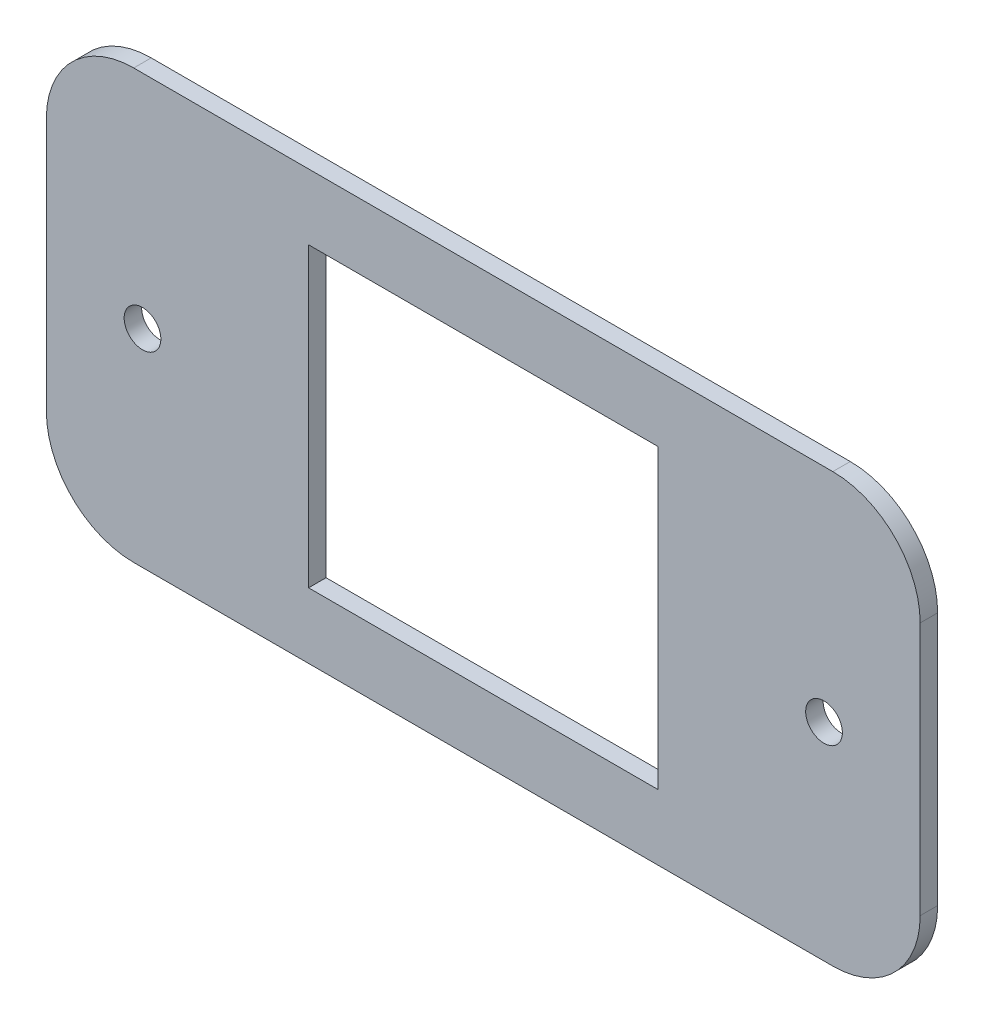
from build123d import *

# Parameters (mm, degrees)
SKETCH1_W           = 100.01257602
SKETCH1_H           = 49.015555291
SKETCH1_R           = 2.1
SKETCH1_W_2         = 39.998541852
SKETCH1_H_2         = 34.001078585
BOSS_EXTRUDE1_DEPTH = 2
FILLET1_R           = 10


with BuildPart() as part:
    # Sketch1 → Boss-Extrude1 (new body)
    with BuildSketch(Plane.XY):
        with Locations((-5, 1.804116785)):
            Rectangle(SKETCH1_W, SKETCH1_H)
        with Locations((-44, 0.98172734)):
            Circle(SKETCH1_R, mode=Mode.SUBTRACT)
        with Locations((34, 0.98172734)):
            Circle(SKETCH1_R, mode=Mode.SUBTRACT)
        with Locations((-4.990588882, 1.794943283)):
            Rectangle(SKETCH1_W_2, SKETCH1_H_2, mode=Mode.SUBTRACT)
    extrude(amount=BOSS_EXTRUDE1_DEPTH)

    # Fillet1
    fillet1_edges = [part.edges().sort_by_distance(p)[0] for p in [
        (-55.00628801, 26.311894431, 1),
        (45.00628801, 26.311894431, 1),
        (45.00628801, -22.70366086, 1),
        (-55.00628801, -22.70366086, 1),
    ]]
    fillet(fillet1_edges, radius=FILLET1_R)


solid = part.part
